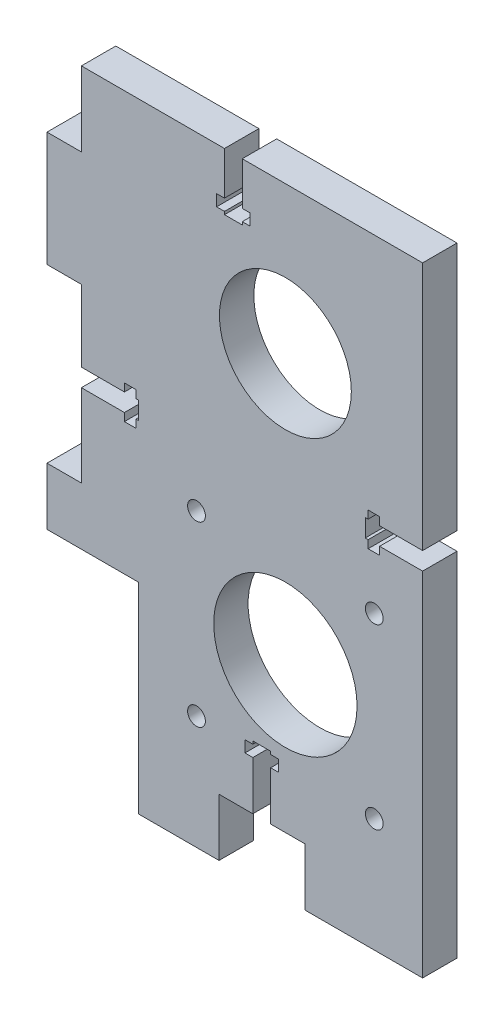
from build123d import *

# Parameters (mm, degrees)
SZKIC1_W                    = 65.5
SZKIC1_H                    = 114
DODANIE_WYCI_GNI_CIE1_DEPTH = 6
SZKIC2_R                    = 12.5
WYTNIJ_WYCI_GNI_CIE2_DEPTH  = 6
SZKIC4_R                    = 1.55
WYTNIJ_WYCI_GNI_CIE3_DEPTH  = 6
SZKIC5_W                    = 15
SZKIC5_H                    = 10
SZKIC5_W_2                  = 6
SZKIC5_H_2                  = 30
WYTNIJ_WYCI_GNI_CIE4_DEPTH  = 6
WYTNIJ_WYCI_GNI_CIE5_DEPTH  = 6
WYTNIJ_WYCI_GNI_CIE6_DEPTH  = 6
SZKIC8_R                    = 11.5
WYTNIJ_WYCI_GNI_CIE7_DEPTH  = 10


with BuildPart() as part:
    # Szkic1 → Dodanie-wyciągnięcie1 (new body)
    with BuildSketch(Plane.XY):
        with Locations((23.742718173, 26.167032616)):
            Rectangle(SZKIC1_W, SZKIC1_H)
    extrude(amount=DODANIE_WYCI_GNI_CIE1_DEPTH)

    # Szkic2 → Wytnij-wyciągnięcie2 (cut)
    with BuildSketch(Plane.XY.offset(6)):
        with Locations((32.562718173, 4.504913836)):
            Circle(SZKIC2_R)
    extrude(amount=-WYTNIJ_WYCI_GNI_CIE2_DEPTH, mode=Mode.SUBTRACT)

    # Szkic4 → Wytnij-wyciągnięcie3 (cut)
    with BuildSketch(Plane(origin=(0, 0, 0), x_dir=(-1, 0, 0), z_dir=(0, 0, -1))):
        with Locations((-17.062718173, -10.995086164)):
            Circle(SZKIC4_R)
        with Locations((-17.062718173, 20.004913836)):
            Circle(SZKIC4_R)
        with Locations((-48.062718173, 20.004913836)):
            Circle(SZKIC4_R)
        with Locations((-48.062718173, -10.995086164)):
            Circle(SZKIC4_R)
    extrude(amount=-WYTNIJ_WYCI_GNI_CIE3_DEPTH, mode=Mode.SUBTRACT)

    # Szkic5 → Wytnij-wyciągnięcie4 (cut)
    with BuildSketch(Plane.XY.offset(6)):
        Polygon((-9.007281827, 4.167032616), (-9.007281827, -30.832967384), (6.992718173, -30.832967384), (6.992718173, 4.167032616), (-3.007281827, 4.167032616), align=None)
        with Locations((28.492718173, -25.832967384)):
            Rectangle(SZKIC5_W, SZKIC5_H)
        Polygon((56.492718173, 77.167032616), (56.492718173, 83.167032616), (-9.007281827, 83.167032616), (-9.007281827, 64.167032616), (-3.007281827, 64.167032616), (-3.007281827, 77.167032616), align=None)
        with Locations((-6.007281827, 29.167032616)):
            Rectangle(SZKIC5_W_2, SZKIC5_H_2)
    extrude(amount=-WYTNIJ_WYCI_GNI_CIE4_DEPTH, mode=Mode.SUBTRACT)

    # Szkic6 → Wytnij-wyciągnięcie5 (cut)
    with BuildSketch(Plane.XY.offset(6)):
        Polygon((-3.007281827, 31.667032616), (4.492718173, 31.667032616), (4.492718173, 33.042032616), (6.492718173, 33.042032616), (6.492718173, 31.667032616), (6.992718173, 31.667032616), (6.992718173, 28.567032616), (6.492718173, 28.567032616), (6.492718173, 27.192032616), (4.492718173, 27.192032616), (4.492718173, 28.567032616), (-3.007281827, 28.567032616), align=None)
        Polygon((26.892718173, -20.832967384), (29.992718173, -20.832967384), (29.992718173, -12.332967384), (31.367718173, -12.332967384), (31.367718173, -10.332967384), (29.992718173, -10.332967384), (29.992718173, -9.832967384), (26.892718173, -9.832967384), (26.892718173, -10.332967384), (25.517718173, -10.332967384), (25.517718173, -12.332967384), (26.892718173, -12.332967384), align=None)
    extrude(amount=-WYTNIJ_WYCI_GNI_CIE5_DEPTH, mode=Mode.SUBTRACT)

    # Szkic7 → Wytnij-wyciągnięcie6 (cut)
    with BuildSketch(Plane.XY.offset(6)):
        Polygon((56.492718173, 33.717032616), (48.992718173, 33.717032616), (48.992718173, 35.092032616), (46.992718173, 35.092032616), (46.992718173, 33.717032616), (46.492718173, 33.717032616), (46.492718173, 30.617032616), (46.992718173, 30.617032616), (46.992718173, 29.242032616), (48.992718173, 29.242032616), (48.992718173, 30.617032616), (56.492718173, 30.617032616), align=None)
        Polygon((21.942718173, 69.667032616), (20.567718173, 69.667032616), (20.567718173, 67.667032616), (21.942718173, 67.667032616), (21.942718173, 67.167032616), (25.042718173, 67.167032616), (25.042718173, 67.667032616), (26.417718173, 67.667032616), (26.417718173, 69.667032616), (25.042718173, 69.667032616), (25.042718173, 77.167032616), (21.942718173, 77.167032616), align=None)
    extrude(amount=-WYTNIJ_WYCI_GNI_CIE6_DEPTH, mode=Mode.SUBTRACT)

    # Szkic8 → Wytnij-wyciągnięcie7 (cut)
    with BuildSketch(Plane.XY.offset(6)):
        with Locations((32.562718173, 51.504913836)):
            Circle(SZKIC8_R)
    extrude(amount=-WYTNIJ_WYCI_GNI_CIE7_DEPTH, mode=Mode.SUBTRACT)


solid = part.part
